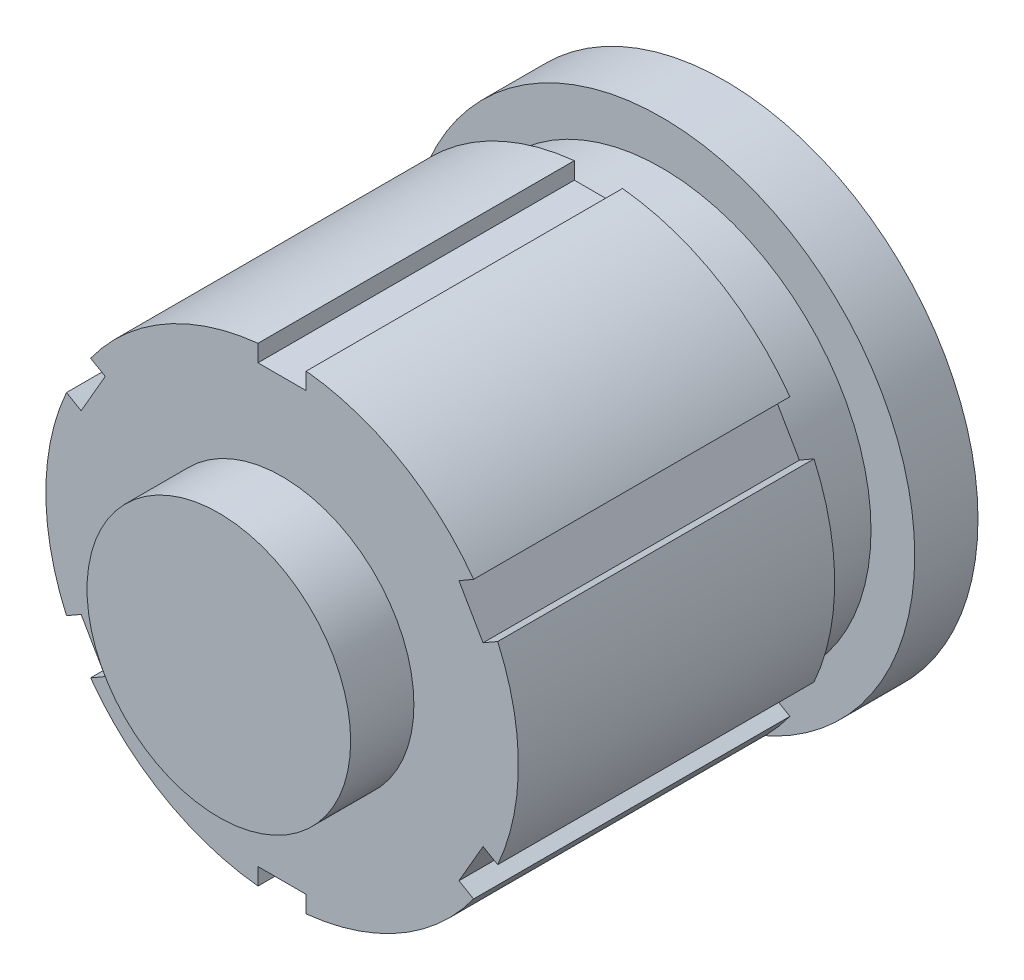
from build123d import *

# Parameters (mm, degrees)
CROQUIS1_R              = 20
SALIENTE_EXTRUIR5_DEPTH = 5
CROQUIS6_R              = 16.544256432
SALIENTE_EXTRUIR6_DEPTH = 5
CROQUIS7_R              = 18.673739687
SALIENTE_EXTRUIR7_DEPTH = 25
CROQUIS8_W              = 3.810951086
CROQUIS8_H              = 2.867445731
CORTAR_EXTRUIR2_DEPTH   = 25
CROQUIS9_R              = 10.417374192
SALIENTE_EXTRUIR9_DEPTH = 5


with BuildPart() as part:
    # Croquis1 → Saliente-Extruir5 (new body)
    with BuildSketch(Plane.XY):
        Circle(CROQUIS1_R)
    extrude(amount=SALIENTE_EXTRUIR5_DEPTH)

    # Croquis6 → Saliente-Extruir6 (add)
    with BuildSketch(Plane.XY.offset(5)):
        Circle(CROQUIS6_R)
    extrude(amount=SALIENTE_EXTRUIR6_DEPTH)

    # Croquis7 → Saliente-Extruir7 (add)
    with BuildSketch(Plane.XY.offset(10)):
        Circle(CROQUIS7_R)
    extrude(amount=SALIENTE_EXTRUIR7_DEPTH)

    # Croquis8 → Cortar-Extruir2 (cut)
    with BuildSketch(Plane.XY.offset(35)):
        with Locations((0, 18.673739686)):
            Rectangle(CROQUIS8_W, CROQUIS8_H)
        Polygon((16.460835604, 11.703921503), (13.977554757, 10.270198637), (15.8830303, 6.969818184), (18.366311148, 8.403541049), align=None)
        Polygon((18.366311148, -8.403541049), (15.8830303, -6.969818184), (13.977554757, -10.270198637), (16.460835604, -11.703921503), align=None)
        with Locations((0, -18.673739686)):
            Rectangle(CROQUIS8_W, CROQUIS8_H)
        Polygon((-16.460835604, -11.703921503), (-13.977554757, -10.270198637), (-15.8830303, -6.969818184), (-18.366311148, -8.403541049), align=None)
        Polygon((-18.366311148, 8.403541049), (-15.8830303, 6.969818184), (-13.977554757, 10.270198637), (-16.460835604, 11.703921503), align=None)
    extrude(amount=-CORTAR_EXTRUIR2_DEPTH, mode=Mode.SUBTRACT)

    # Croquis9 → Saliente-Extruir9 (add)
    with BuildSketch(Plane.XY.offset(35)):
        Circle(CROQUIS9_R)
    extrude(amount=SALIENTE_EXTRUIR9_DEPTH)


solid = part.part
